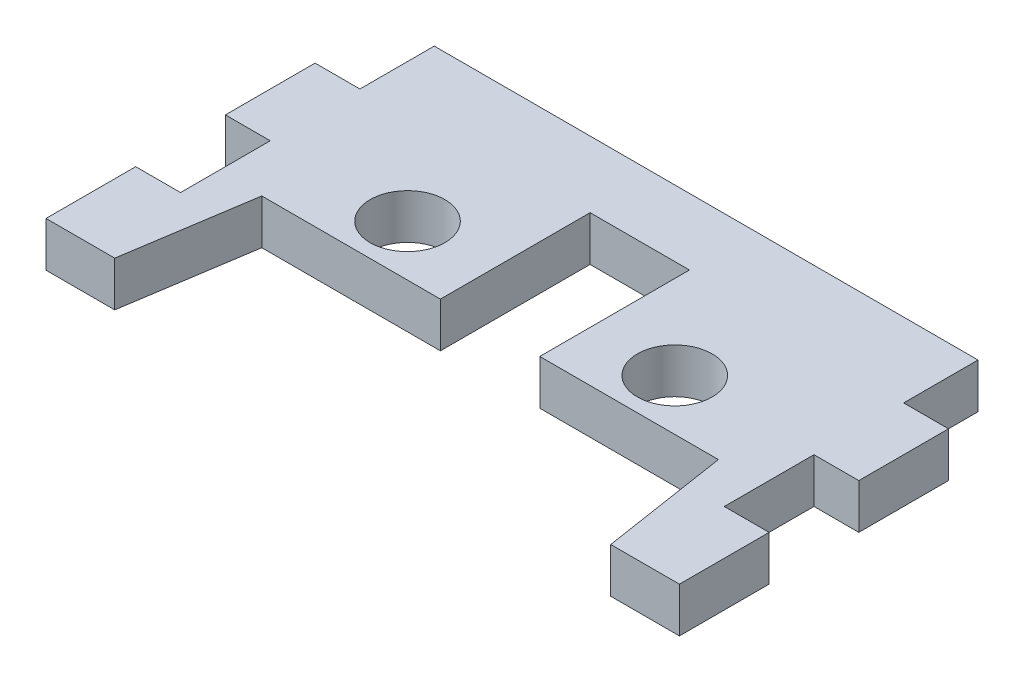
from build123d import *

# Parameters (mm, degrees)
SKETCH1_R           = 5
BOSS_EXTRUDE1_DEPTH = 6


with BuildPart() as part:
    # Sketch1 → Boss-Extrude1 (new body)
    with BuildSketch(Plane(origin=(0, 0, 0), x_dir=(1, 0, 0), z_dir=(0, 1, 0))):
        Polygon((13.673278968, -16.635546923), (4.478237082, -16.635546923), (4.478237082, -4.635546923), (10.478237082, -4.635546923), (10.478237082, 7.364453077), (4.478237082, 7.364453077), (4.478237082, 19.364453077), (10.478237082, 19.364453077), (10.478237082, 29.311113477), (83.225400432, 29.311113477), (83.225400432, 19.364453077), (89.225400432, 19.364453077), (89.225400432, 7.364453077), (83.225400432, 7.364453077), (83.225400432, -4.635546923), (89.225400432, -4.635546923), (89.225400432, -16.635546923), (80.030358547, -16.635546923), (77.395115136, 0.405693798), (53.496778433, 0.405693798), (53.496778433, 20.432362651), (40.206859082, 20.432362651), (40.206859082, 0.405693798), (16.308522379, 0.405693798), align=None)
        with Locations(Location((28.974519722, 7.237839647, 0), (0, 0, 270))):
            Circle(SKETCH1_R, mode=Mode.SUBTRACT)
        with Locations(Location((64.729117792, 7.237839647, 0), (0, 0, 270))):
            Circle(SKETCH1_R, mode=Mode.SUBTRACT)
    extrude(amount=BOSS_EXTRUDE1_DEPTH)


solid = part.part
